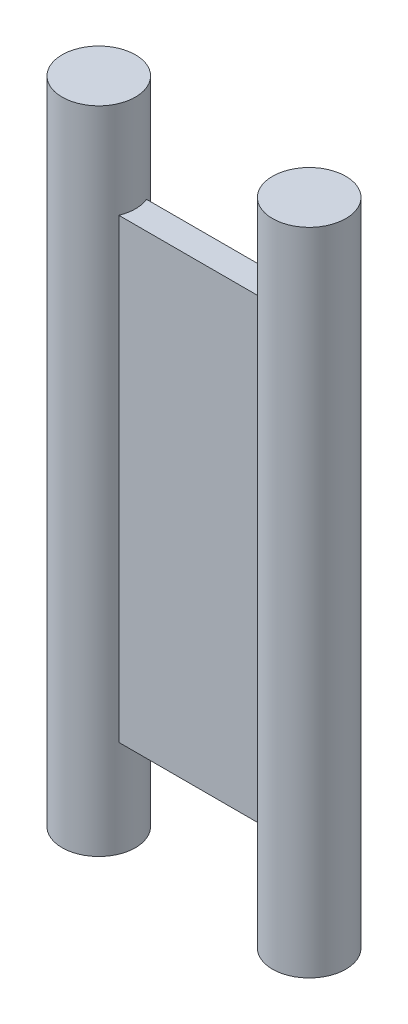
from build123d import *

# Parameters (mm, degrees)
SKETCH1_W           = 7.606
SKETCH1_H           = 1
BOSS_EXTRUDE1_DEPTH = 16.5
SKETCH2_R           = 1.325
BOSS_EXTRUDE2_DEPTH = 11.75


with BuildPart() as part:
    # Sketch1 → Boss-Extrude1 (new body)
    with BuildSketch(Plane(origin=(0, 0, 0), x_dir=(1, 0, 0), z_dir=(0, 1, 0))):
        Rectangle(SKETCH1_W, SKETCH1_H)
    extrude(amount=BOSS_EXTRUDE1_DEPTH)

    # Sketch2 → Boss-Extrude2 (add, symmetric)
    with BuildSketch(Plane(origin=(0, 8.25, 0), x_dir=(1, 0, 0), z_dir=(0, 1, 0))):
        with Locations(Location((-3.803, 0, 0), (0, 0, 270))):
            Circle(SKETCH2_R)
        with Locations(Location((3.803, 0, 0), (0, 0, 270))):
            Circle(SKETCH2_R)
    extrude(amount=BOSS_EXTRUDE2_DEPTH, both=True)


solid = part.part
